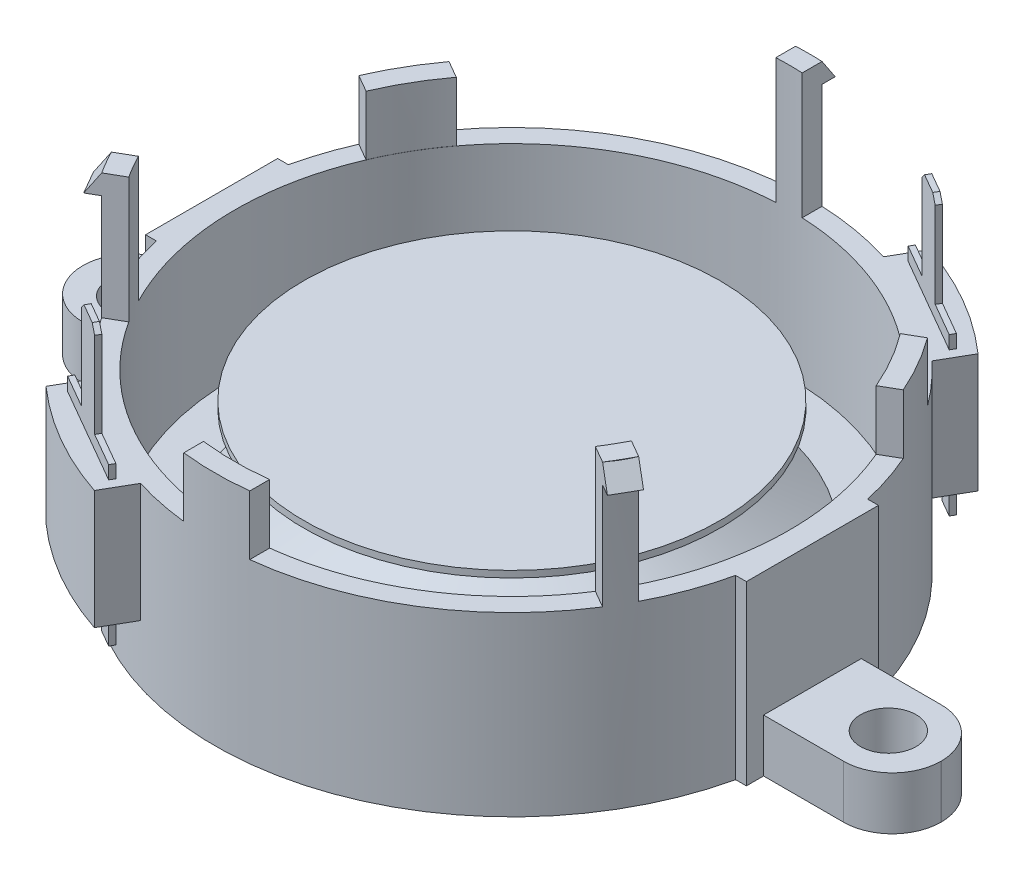
from build123d import *
from build123d.topology import SkipClean

# Parameters (mm, degrees)
SKETCH_1_R               = 22.5
EXTRUDE_1_DEPTH          = 13.4
SKETCH_2_R               = 2.1
EXTRUDE_2_DEPTH          = 4
FILLET_1_R               = 3.69
EXTRUDE_3_DEPTH          = 9.5
EXTRUDE_START            = -2
EXTRUDE_5_DEPTH          = 2
EXTRUDE_4_DEPTH          = 4.5
CUT_EXTRUDE_START        = -11
SKETCH_5_R               = 21.001588026
CUT_EXTRUDE_1_DEPTH      = 11
SKETCH_6_R               = 8
CUT_EXTRUDE_2_DEPTH      = 3
PATTERN_CIRCULAR_1_COUNT = 3
EXTRUDE_START_2          = -9
EXTRUDE_6_DEPTH          = 9
EXTRUDE_7_DEPTH          = 1
EXTRUDE_8_DEPTH          = 7
CHAMFER_1_SIZE           = 0.5
SKETCH_13_R              = 9.5
CUT_EXTRUDE_4_DEPTH      = 2
EXTRUDE_10_DEPTH         = 13.4
SKETCH_18_W              = 1.5
SKETCH_18_H              = 11.9
EXTRUDE_11_DEPTH         = 0.4


with BuildPart() as part:
    # Эскиз1 → Бобышка-Вытянуть1 (new body)
    with BuildSketch(Plane(origin=(0, 0, 0), x_dir=(1, 0, 0), z_dir=(0, 1, 0))):
        with Locations(Location((0, 0, 0), (0, 0, 270))):
            Circle(SKETCH_1_R)
    extrude(amount=EXTRUDE_1_DEPTH)

    # Эскиз2 → Бобышка-Вытянуть2 (add)
    # profile 1 of 2: a face of its own
    with BuildSketch(Plane.XZ):
        with BuildLine():
            Line((22.193692798, 3.7), (32.5, 3.7))
            Line((32.5, 3.7), (32.5, -3.7))
            Line((32.5, -3.7), (22.193692798, -3.7))
            ThreePointArc((22.193692798, -3.7), (22.5, 0), (22.193692798, 3.7))
        make_face()
        with Locations(Location((28.5, 0, 0), (0, 0, 270))):
            Circle(SKETCH_2_R, mode=Mode.SUBTRACT)
    # profile 2 of 2: a face of its own
    with BuildSketch(Plane.XZ):
        with BuildLine():
            Line((-22.193692798, -3.7), (-32.5, -3.7))
            Line((-32.5, -3.7), (-32.5, 3.7))
            Line((-32.5, 3.7), (-22.193692798, 3.7))
            ThreePointArc((-22.193692798, 3.7), (-22.5, 0), (-22.193692798, -3.7))
        make_face()
        with Locations(Location((-28.5, 0, 0), (0, 0, 90))):
            Circle(SKETCH_2_R, mode=Mode.SUBTRACT)
    extrude(amount=-EXTRUDE_2_DEPTH)

    # Скругление1
    fillet_1_edges = [part.edges().sort_by_distance(p)[0] for p in [
        (-32.5, 2, -3.7),
        (-32.5, 2, 3.7),
        (32.5, 2, 3.7),
        (32.5, 2, -3.7),
    ]]
    fillet(fillet_1_edges, radius=FILLET_1_R)

    # Эскиз3 → Бобышка-Вытянуть3 (add)
    with BuildSketch(Plane(origin=(0, 13.4, 0), x_dir=(1, 0, 0), z_dir=(0, 1, 0))):
        with BuildLine():
            Line((-1, 22.477766793), (-1, 20.977766793))
            ThreePointArc((-1, 20.977766793), (0, 21.001588026), (1, 20.977766793))
            Line((1, 20.977766793), (1, 22.477766793))
            ThreePointArc((1, 22.477766793), (0, 22.5), (-1, 22.477766793))
        make_face()
        with BuildLine():
            Line((19.966317063, -10.372857993), (18.667278957, -9.622857993))
            ThreePointArc((18.667278957, -9.622857993), (18.18790875, -10.500794013), (17.667278957, -11.3549088))
            Line((17.667278957, -11.3549088), (18.966317063, -12.1049088))
            ThreePointArc((18.966317063, -12.1049088), (19.485571585, -11.25), (19.966317063, -10.372857993))
        make_face()
        with BuildLine():
            Line((-18.966317063, -12.1049088), (-17.667278957, -11.3549088))
            ThreePointArc((-17.667278957, -11.3549088), (-18.18790875, -10.500794013), (-18.667278957, -9.622857993))
            Line((-18.667278957, -9.622857993), (-19.966317063, -10.372857993))
            ThreePointArc((-19.966317063, -10.372857993), (-19.485571585, -11.25), (-18.966317063, -12.1049088))
        make_face()
    extrude(amount=EXTRUDE_3_DEPTH)

    # Эскиз7 → Бобышка-Вытянуть5 (add)
    with BuildSketch(Plane.ZY.offset(1).offset(EXTRUDE_START)):
        Polygon((-22.477766793, 22.9), (-23.477766793, 21.4), (-22.477766793, 21.4), align=None)
    extrude_5 = extrude(amount=EXTRUDE_5_DEPTH)

    # Эскиз4 → Бобышка-Вытянуть4 (add)
    with BuildSketch(Plane(origin=(0, 13.4, 0), x_dir=(1, 0, 0), z_dir=(0, 1, 0))):
        with BuildLine():
            Line((-2.5, -20.860679775), (-2.5, -22.360679775))
            ThreePointArc((-2.5, -22.360679775), (0, -22.5), (2.5, -22.360679775))
            Line((2.5, -22.360679775), (2.5, -20.860679775))
            ThreePointArc((2.5, -20.860679775), (0, -21.009949088), (-2.5, -20.860679775))
        make_face()
        with BuildLine():
            Line((-16.815878625, 12.595403397), (-18.114916731, 13.345403397))
            ThreePointArc((-18.114916731, 13.345403397), (-19.485571585, 11.25), (-20.614916731, 9.015276378))
            Line((-20.614916731, 9.015276378), (-19.315878625, 8.265276378))
            ThreePointArc((-19.315878625, 8.265276378), (-18.195149642, 10.504974544), (-16.815878625, 12.595403397))
        make_face()
        with BuildLine():
            Line((19.315878625, 8.265276378), (20.614916731, 9.015276378))
            ThreePointArc((20.614916731, 9.015276378), (19.485571585, 11.25), (18.114916731, 13.345403397))
            Line((18.114916731, 13.345403397), (16.815878625, 12.595403397))
            ThreePointArc((16.815878625, 12.595403397), (18.195149642, 10.504974544), (19.315878625, 8.265276378))
        make_face()
    extrude(amount=EXTRUDE_4_DEPTH)

    # Эскиз5 → Вырез-Вытянуть1 (cut)
    with SkipClean():  # the faces are left unmerged after this step: merging them gives an invalid solid
        with BuildSketch(Plane(origin=(0, 13.4, 0), x_dir=(1, 0, 0), z_dir=(0, 1, 0)).offset(CUT_EXTRUDE_START)):
            with Locations(Location((0, 0, 0), (0, 0, 87.270803902))):
                Circle(SKETCH_5_R)
        extrude(amount=CUT_EXTRUDE_1_DEPTH, mode=Mode.SUBTRACT)

    # Эскиз6 → Вырез-Вытянуть2 (cut)
    with SkipClean():  # the faces are left unmerged after this step: merging them gives an invalid solid
        with BuildSketch(Plane(origin=(0, 0, 0), x_dir=(-1, 0, 0), z_dir=(0, -1, 0))):
            with Locations(Location((0, 0, 0), (0, 0, 90))):
                Circle(SKETCH_6_R)
        extrude(amount=-CUT_EXTRUDE_2_DEPTH, mode=Mode.SUBTRACT)

    # Круговой массив1: Бобышка-Вытянуть5 ×3 about axis
    with SkipClean():  # the faces are left unmerged after this step: merging them gives an invalid solid
        pattern_circular_1_axis = Axis((0, 0, 0), (0, 1, 0))
        for i in range(1, PATTERN_CIRCULAR_1_COUNT):
            add(extrude_5.rotate(pattern_circular_1_axis, i * 360 / PATTERN_CIRCULAR_1_COUNT))

    # Эскиз8 → Бобышка-Вытянуть6 (add)
    with SkipClean():  # the faces are left unmerged after this step: merging them gives an invalid solid
        with BuildSketch(Plane(origin=(0, 13.4, 0), x_dir=(1, 0, 0), z_dir=(0, 1, 0)).offset(EXTRUDE_START_2)):
            with BuildLine():
                Line((7.917321695, 23.713203436), (6.638578465, 21.498355192))
                ThreePointArc((6.638578465, 21.498355192), (11.25, 19.485571585), (15.298832503, 16.498355192))
                Line((15.298832503, 16.498355192), (16.577575733, 18.713203436))
                ThreePointArc((16.577575733, 18.713203436), (12.5, 21.650635095), (7.917321695, 23.713203436))
            make_face()
            with BuildLine():
                Line((-7.917321695, -23.713203436), (-6.638578465, -21.498355192))
                ThreePointArc((-6.638578465, -21.498355192), (-11.25, -19.485571585), (-15.298832503, -16.498355192))
                Line((-15.298832503, -16.498355192), (-16.577575733, -18.713203436))
                ThreePointArc((-16.577575733, -18.713203436), (-12.5, -21.650635095), (-7.917321695, -23.713203436))
            make_face()
        extrude(amount=EXTRUDE_6_DEPTH)

    # Эскиз9 → Бобышка-Вытянуть7 (add)
    with SkipClean():  # the faces are left unmerged after this step: merging them gives an invalid solid
        with BuildSketch(Plane(origin=(0, 13.4, 0), x_dir=(1, 0, 0), z_dir=(0, 1, 0))):
            Polygon((8.069392034, 22.476596989), (7.869392034, 22.130186827), (15.230607966, 17.880186827), (15.430607966, 18.226596989), align=None)
            Polygon((-8.069392034, -22.476596989), (-15.430607966, -18.226596989), (-15.230607966, -17.880186827), (-7.869392034, -22.130186827), align=None)
        extrude(amount=EXTRUDE_7_DEPTH)

    # Эскиз10 → Бобышка-Вытянуть8 (add)
    with SkipClean():  # the faces are left unmerged after this step: merging them gives an invalid solid
        with BuildSketch(Plane(origin=(0, 14.4, 0), x_dir=(1, 0, 0), z_dir=(0, 1, 0))):
            Polygon((10.580865705, 21.026596989), (10.380865705, 20.680186827), (12.719134295, 19.330186827), (12.919134295, 19.676596989), align=None)
            Polygon((-10.580865705, -21.026596989), (-12.919134295, -19.676596989), (-12.719134295, -19.330186827), (-10.380865705, -20.680186827), align=None)
        extrude(amount=EXTRUDE_8_DEPTH)

    # Фаска1
    chamfer_1_edges = [part.edges().sort_by_distance(p)[0] for p in [
        (10.480865705, 21.4, -20.853391908),
        (12.819134295, 21.4, -19.503391908),
        (-10.480865705, 21.4, 20.853391908),
        (-12.819134295, 21.4, 19.503391908),
    ]]
    chamfer(chamfer_1_edges, length=CHAMFER_1_SIZE)

    # Эскиз11 → Повернуть1 (revolve)
    with SkipClean():  # the faces are left unmerged after this step: merging them gives an invalid solid
        with BuildSketch(Plane(origin=(0, 0, 0), x_dir=(0, 0, -1), z_dir=(1, 0, 0))):
            Polygon((20.5, 2.4), (17.5, 2.4), (4.99, 9.622651868), (4.99, 10.9), (15.74, 10.9), (15.74, 11.4), (-0.01, 11.4), (-0.01, 10.9), (4.49, 10.9), (4.49, 9.333976733), (17.366025404, 1.9), (20.5, 1.9), align=None)
        revolve(axis=Axis((0, 0, 0.01), (0, 1, 0)))

    # Эскиз13 → Вырез-Вытянуть4 (cut)
    with SkipClean():  # the faces are left unmerged after this step: merging them gives an invalid solid
        with BuildSketch(Plane.XZ):
            with Locations(Location((0, 0, 0), (0, 0, 270))):
                Circle(SKETCH_13_R)
        extrude(amount=-CUT_EXTRUDE_4_DEPTH, mode=Mode.SUBTRACT)

    # Эскиз15 → Бобышка-Вытянуть10 (add)
    with SkipClean():  # the faces are left unmerged after this step: merging them gives an invalid solid
        with BuildSketch(Plane.XZ):
            with BuildLine():
                Line((-21.937410968, 5), (-22.75, 5))
                Line((-22.75, 5), (-22.75, -5))
                Line((-22.75, -5), (-21.937410968, -5))
                ThreePointArc((-21.937410968, -5), (-22.5, 0), (-21.937410968, 5))
            make_face()
            with BuildLine():
                Line((22.75, 5), (22.75, -5))
                Line((22.75, -5), (21.937410968, -5))
                ThreePointArc((21.937410968, -5), (22.5, 0), (21.937410968, 5))
                Line((21.937410968, 5), (22.75, 5))
            make_face()
        extrude(amount=-EXTRUDE_10_DEPTH)

    # Эскиз18 → Бобышка-Вытянуть11 (add)
    with SkipClean():  # the faces are left unmerged after this step: merging them gives an invalid solid
        with BuildSketch(Plane(origin=(11.75, 0, -20.351596989), x_dir=(-0.8660254037844386, 0, -0.5), z_dir=(0.5000000000000001, 0, -0.8660254037844387))):
            with Locations((-3.5, 8.45)):
                Rectangle(SKETCH_18_W, SKETCH_18_H)
            with Locations((3.5, 8.45)):
                Rectangle(SKETCH_18_W, SKETCH_18_H)
        extrude_11 = extrude(amount=-EXTRUDE_11_DEPTH)

    # Зеркальное отражение1: Бобышка-Вытянуть11 across plane
    with SkipClean():  # the faces are left unmerged after this step: merging them gives an invalid solid
        add(extrude_11.mirror(Plane(origin=(0, 0, 0), x_dir=(0.8660254037844386, 0, 0.5000000000000002), z_dir=(0.5, 0, -0.8660254037844386))))


solid = part.part
